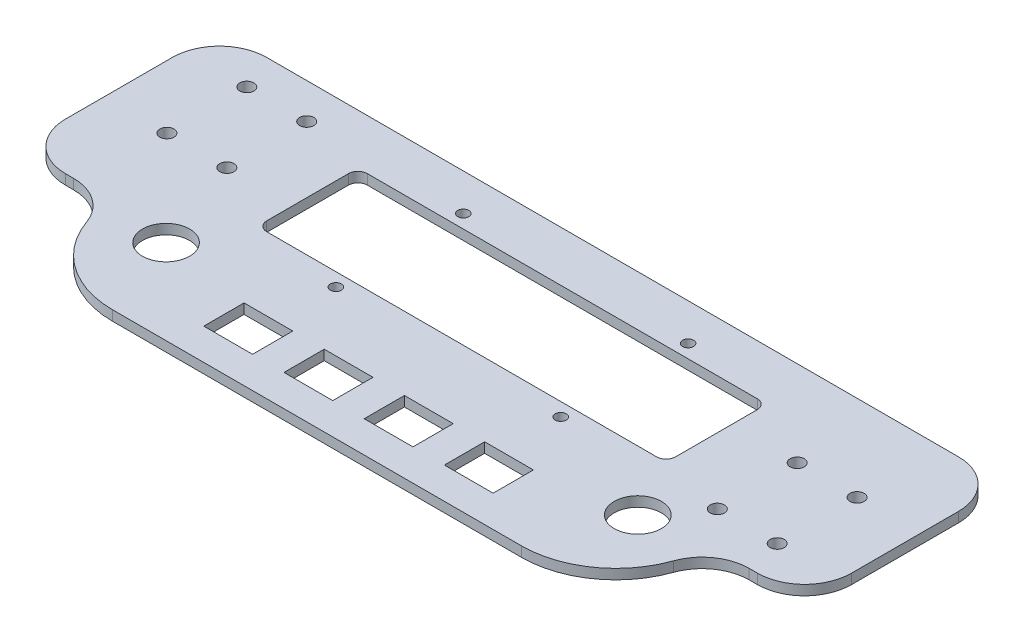
from build123d import *

# Parameters (mm, degrees)
SKETCH3_W            = 130
SKETCH3_H            = 32
SKETCH3_R            = 1.75
BOSS_EXTRUDE1_DEPTH  = 3.175
M4_CLEARANCE_HOLE1_D = 4.5
FILLET1_R            = 15
SKETCH6_W            = 15.5
SKETCH6_H            = 12.8
CUT_EXTRUDE1_DEPTH   = 140.56747696
SKETCH7_R            = 7.5
CUT_EXTRUDE2_DEPTH   = 140.56747696
FILLET2_R            = 3


with BuildPart() as part:
    # Sketch3 → Boss-Extrude1 (new body)
    with BuildSketch(Plane(origin=(0, 0, 0), x_dir=(1, 0, 0), z_dir=(0, 1, 0))):
        with BuildLine():
            Line((-125, 32), (-125, -32))
            Line((-125, -32), (-95, -32))
            ThreePointArc((-95, -32), (-86.213203436, -53.213203436), (-65, -62))
            Line((-65, -62), (65, -62))
            ThreePointArc((65, -62), (86.213203436, -53.213203436), (95, -32))
            Line((95, -32), (125, -32))
            Line((125, -32), (125, 32))
            Line((125, 32), (-125, 32))
        make_face()
        Rectangle(SKETCH3_W, SKETCH3_H, mode=Mode.SUBTRACT)
        with Locations(Location((-35.75, 20.25, 0), (0, 0, 270))):
            Circle(SKETCH3_R, mode=Mode.SUBTRACT)
        with Locations(Location((35.75, 20.25, 0), (0, 0, 270))):
            Circle(SKETCH3_R, mode=Mode.SUBTRACT)
        with Locations(Location((-35.75, -20.25, 0), (0, 0, 270))):
            Circle(SKETCH3_R, mode=Mode.SUBTRACT)
        with Locations(Location((35.75, -20.25, 0), (0, 0, 270))):
            Circle(SKETCH3_R, mode=Mode.SUBTRACT)
    extrude(amount=BOSS_EXTRUDE1_DEPTH)

    # M4 Clearance Hole1 (through all)
    with Locations(Plane(origin=(0, 3.175, 0), x_dir=(1, 0, 0), z_dir=(0, 1, 0))):
        with Locations((-105.025, 20.7), (-85.975, 20.7), (-105.025, -4.7), (-85.975, -4.7), (85.975, 4.7), (105.025, 4.7), (105.025, -20.7), (85.975, -20.7)):
            Hole(M4_CLEARANCE_HOLE1_D / 2)

    # Fillet1
    fillet1_edges = [part.edges().sort_by_distance(p)[0] for p in [
        (-125, 1.5875, 32),
        (-125, 1.5875, -32),
        (125, 1.5875, -32),
        (125, 1.5875, 32),
        (95, 1.5875, 32),
        (-95, 1.5875, 32),
    ]]
    fillet(fillet1_edges, radius=FILLET1_R)

    # Sketch6 → Cut-Extrude1 (cut, through all)
    with BuildSketch(Plane(origin=(0, 3.175, 0), x_dir=(1, 0, 0), z_dir=(0, 1, 0))):
        with Locations((-38.25, -45.6)):
            Rectangle(SKETCH6_W, SKETCH6_H)
        with Locations((-12.75, -45.6)):
            Rectangle(SKETCH6_W, SKETCH6_H)
    cut_extrude1 = extrude(amount=-CUT_EXTRUDE1_DEPTH, mode=Mode.SUBTRACT)

    # Sketch7 → Cut-Extrude2 (cut, through all)
    with BuildSketch(Plane(origin=(0, 3.175, 0), x_dir=(1, 0, 0), z_dir=(0, 1, 0))):
        with Locations(Location((-75, -35, 0), (0, 0, 270))):
            Circle(SKETCH7_R)
    cut_extrude2 = extrude(amount=-CUT_EXTRUDE2_DEPTH, mode=Mode.SUBTRACT)

    # Mirror1: Cut-Extrude1, Cut-Extrude2 across plane
    add(cut_extrude1.mirror(Plane(origin=(0, 0, 0), x_dir=(0, 0, 1), z_dir=(1, 0, 0))), mode=Mode.SUBTRACT)
    add(cut_extrude2.mirror(Plane(origin=(0, 0, 0), x_dir=(0, 0, 1), z_dir=(1, 0, 0))), mode=Mode.SUBTRACT)

    # Fillet2
    fillet2_edges = [part.edges().sort_by_distance(p)[0] for p in [
        (65, 1.5875, 16),
        (65, 1.5875, -16),
        (-65, 1.5875, -16),
        (-65, 1.5875, 16),
    ]]
    fillet(fillet2_edges, radius=FILLET2_R)


solid = part.part
